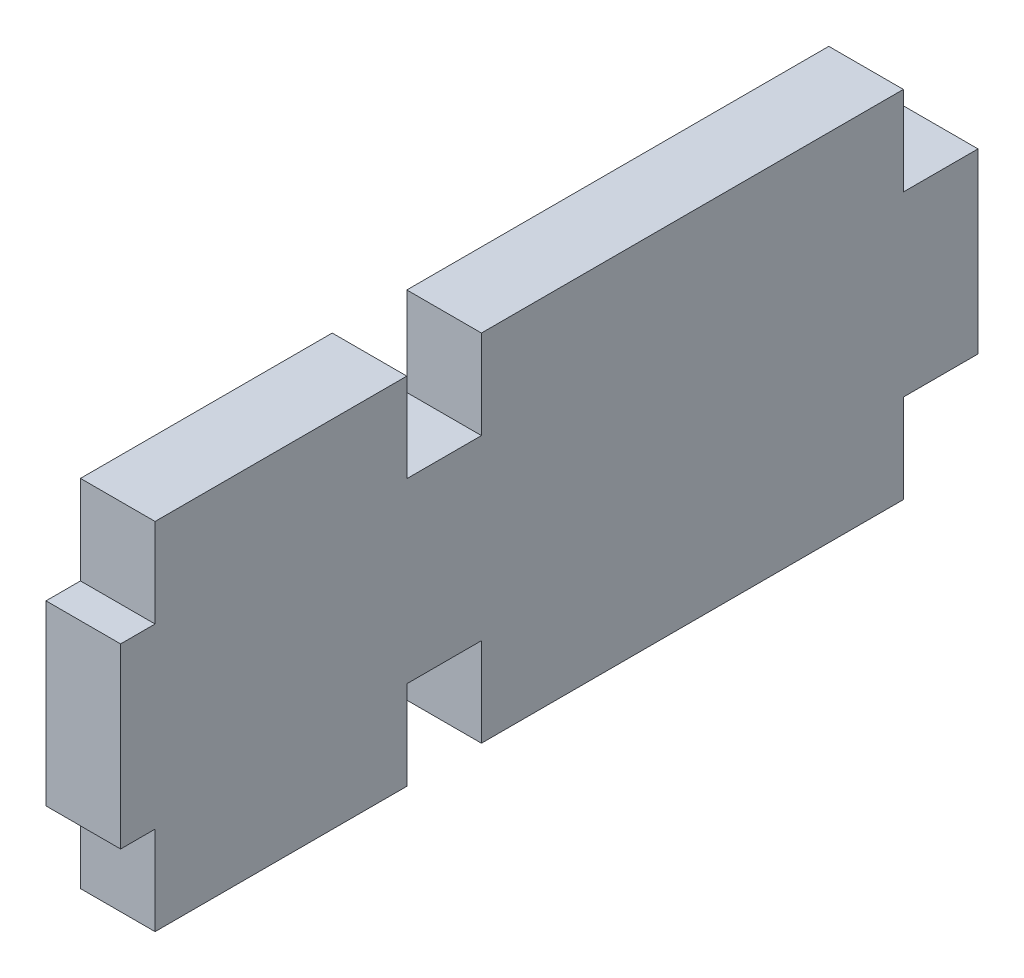
from build123d import *

# Parameters (mm, degrees)
SKETCH1_W           = 61.3
SKETCH1_H           = 25.4
BOSS_EXTRUDE1_DEPTH = 5.334
SKETCH2_W           = 2.4638
SKETCH2_H           = 6.35
SKETCH2_W_2         = 5.334
CUT_EXTRUDE1_DEPTH  = 67.568022023


with BuildPart() as part:
    # Sketch1 → Boss-Extrude1 (new body)
    with BuildSketch(Plane(origin=(0, 0, 0), x_dir=(0, 0, -1), z_dir=(1, 0, 0))):
        with Locations((30.65, 12.7)):
            Rectangle(SKETCH1_W, SKETCH1_H)
    extrude(amount=BOSS_EXTRUDE1_DEPTH)

    # Sketch2 → Cut-Extrude1 (cut, through all)
    with BuildSketch(Plane(origin=(5.334, 0, 0), x_dir=(0, 0, -1), z_dir=(1, 0, 0))):
        with Locations((1.2319, 22.225)):
            Rectangle(SKETCH2_W, SKETCH2_H)
        with Locations((1.2319, 3.175)):
            Rectangle(SKETCH2_W, SKETCH2_H)
        with Locations((23.1308, 22.225)):
            Rectangle(SKETCH2_W_2, SKETCH2_H)
        with Locations((23.1308, 3.175)):
            Rectangle(SKETCH2_W_2, SKETCH2_H)
        with Locations((58.633, 3.175)):
            Rectangle(SKETCH2_W_2, SKETCH2_H)
        with Locations((58.633, 22.225)):
            Rectangle(SKETCH2_W_2, SKETCH2_H)
    extrude(amount=-CUT_EXTRUDE1_DEPTH, mode=Mode.SUBTRACT)


solid = part.part
